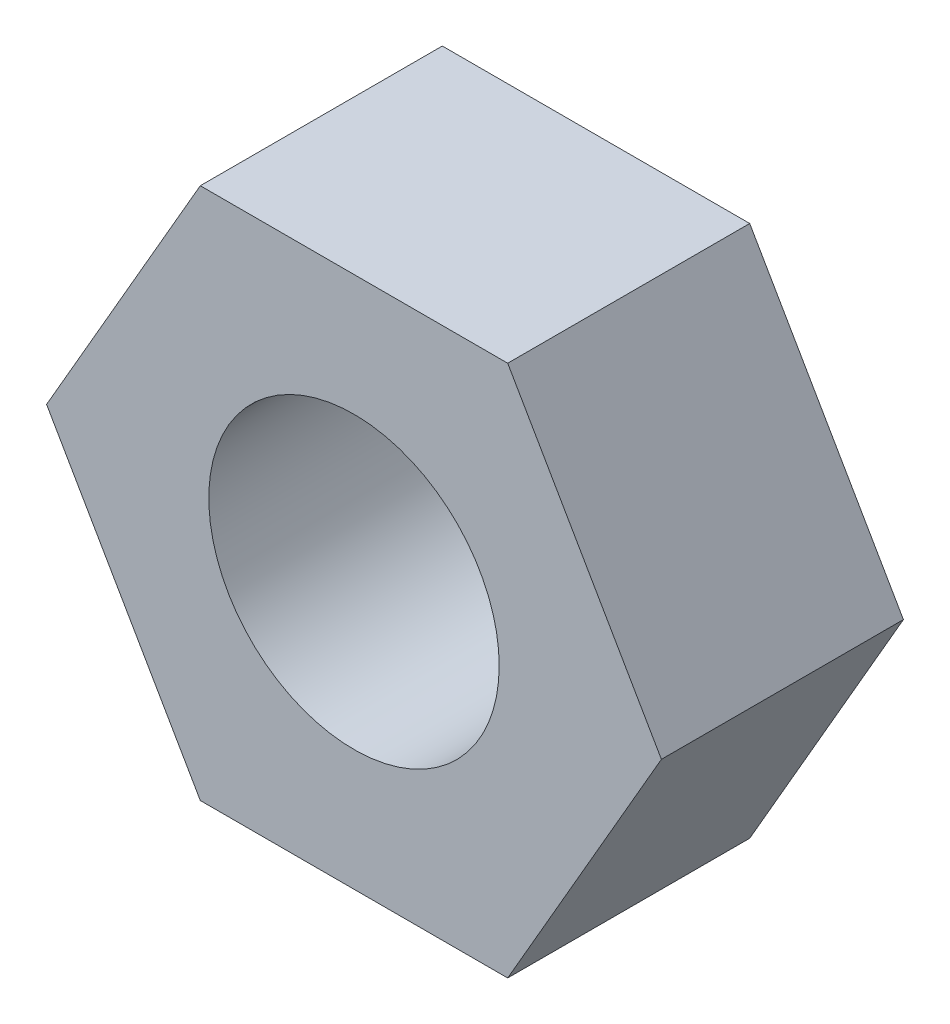
from build123d import *

# Parameters (mm, degrees)
SKETCH_1_R      = 1.5
EXTRUDE_1_DEPTH = 2.5


with BuildPart() as part:
    # 草图1 → 凸台-拉伸1 (new body)
    with BuildSketch(Plane.XY):
        Polygon((3.175426481, 0), (1.58771324, 2.75), (-1.58771324, 2.75), (-3.175426481, 0), (-1.58771324, -2.75), (1.58771324, -2.75), align=None)
        Circle(SKETCH_1_R, mode=Mode.SUBTRACT)
    extrude(amount=EXTRUDE_1_DEPTH)


solid = part.part
